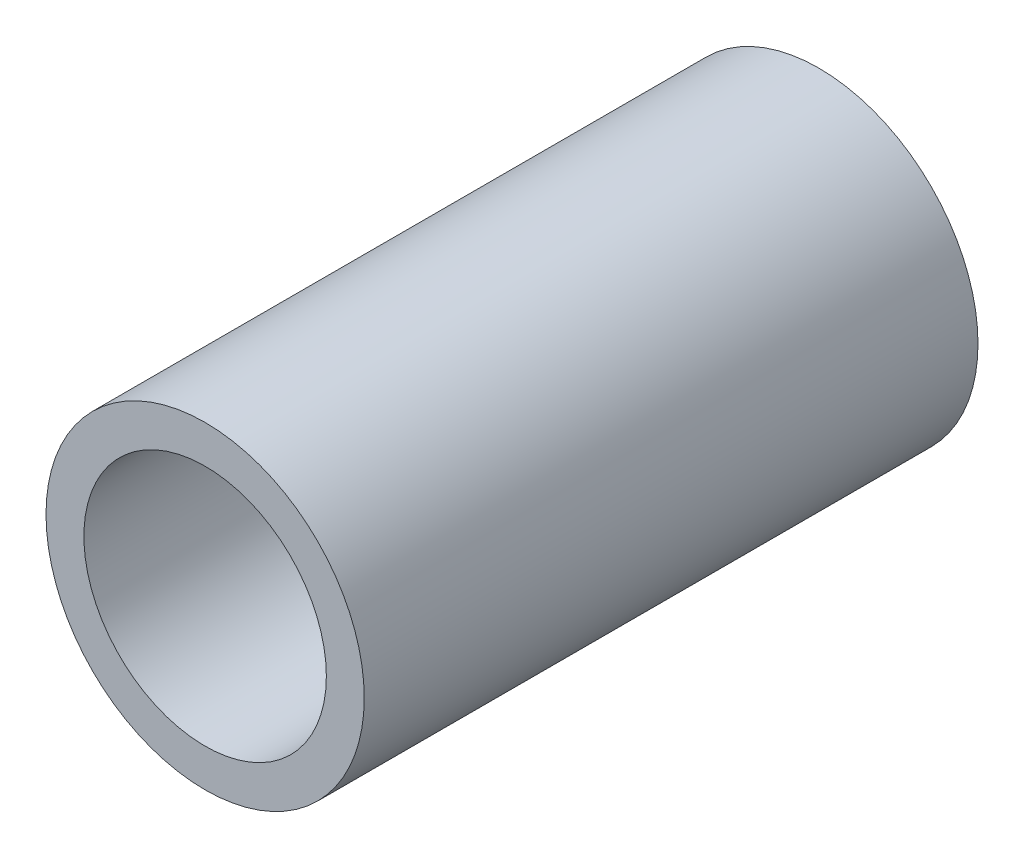
from build123d import *

# Parameters (mm, degrees)
SKETCH1_R           = 0.5334
SKETCH1_R_2         = 0.4064
BOSS_EXTRUDE1_DEPTH = 2.0574


with BuildPart() as part:
    # Sketch1 → Boss-Extrude1 (new body)
    with BuildSketch(Plane.XY):
        Circle(SKETCH1_R)
        Circle(SKETCH1_R_2, mode=Mode.SUBTRACT)
    extrude(amount=BOSS_EXTRUDE1_DEPTH)


solid = part.part
